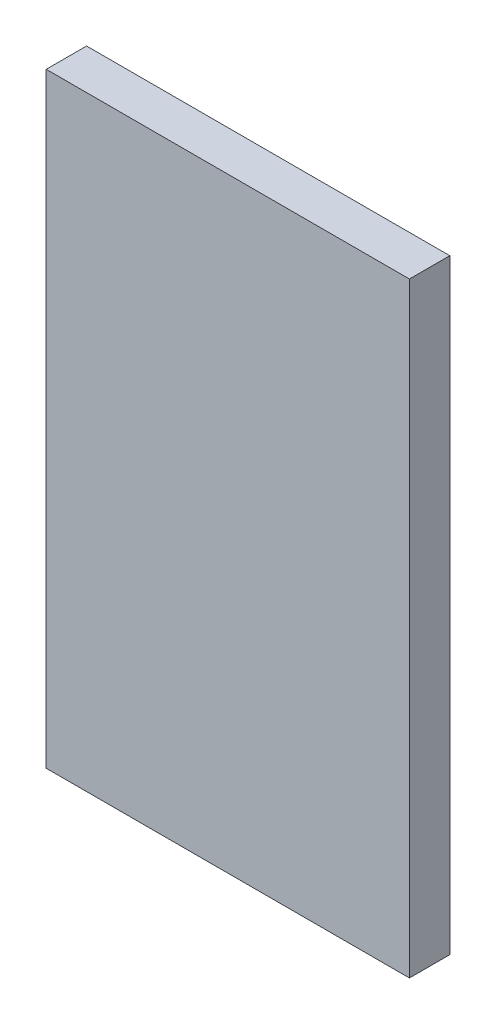
from build123d import *

# Parameters (mm, degrees)
SKETCH1_W           = 18
SKETCH1_H           = 30
BOSS_EXTRUDE1_DEPTH = 2


with BuildPart() as part:
    # Sketch1 → Boss-Extrude1 (new body)
    with BuildSketch(Plane.XY):
        with Locations((9, 15)):
            Rectangle(SKETCH1_W, SKETCH1_H)
    extrude(amount=BOSS_EXTRUDE1_DEPTH)


solid = part.part
